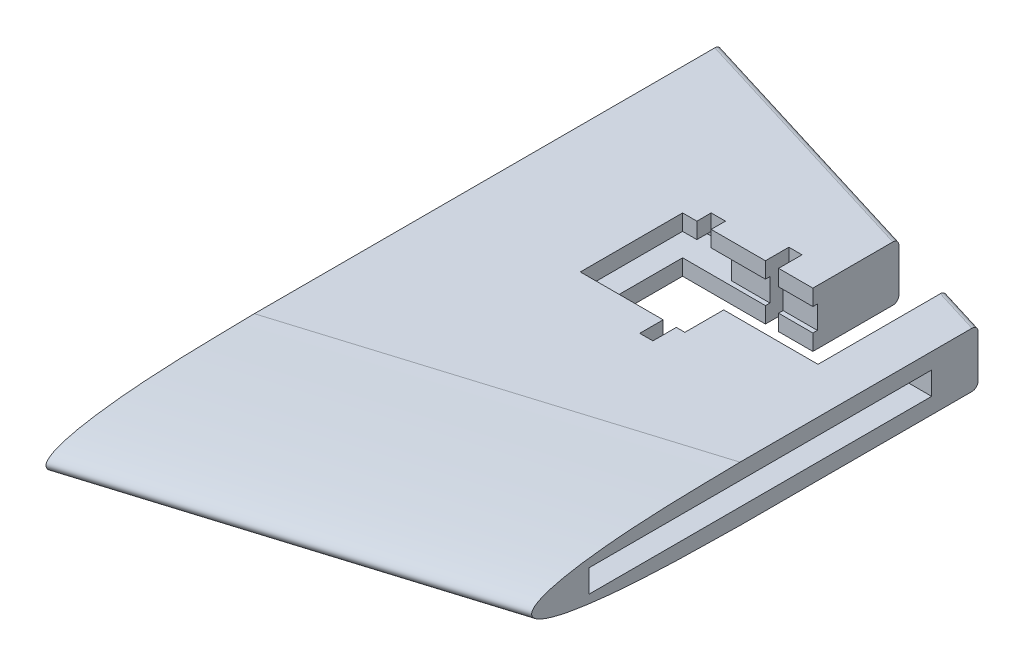
from build123d import *

# Parameters (mm, degrees)
SKETCH7_W          = 76.2
SKETCH7_H          = 5.08
CUT_EXTRUDE3_DEPTH = 194.950570427
CUT_EXTRUDE4_DEPTH = 195.237760021
CUT_EXTRUDE5_DEPTH = 172.648324818
SKETCH10_W         = 15.24
SKETCH10_H         = 38.1
CUT_EXTRUDE6_DEPTH = 172.648324818
SKETCH12_W         = 6.35
SKETCH12_H         = 5.08
CUT_EXTRUDE8_DEPTH = 38.1
CUT_EXTRUDE9_REACH = 173.648
SKETCH13_W         = 3.175
SKETCH13_H         = 3.175
FILLET1_R          = 1.27


with BuildPart() as part:
    # Sweep1: sweep along a path in Sketch4
    with BuildLine(Plane(origin=(0, 0, 0), x_dir=(1, 0, 0), z_dir=(0, 1, 0))) as sweep1_path:
        Line((0, 0), (82.55, 25.4))
    # Sketch3 → Sweep1 (sweep)
    with BuildSketch(Plane(origin=(0, 0, 0), x_dir=(0, 0, -1), z_dir=(1, 0, 0))):
        with BuildLine():
            Line((150, 6.096), (150, -6.096))
            Line((150, -6.096), (46.3, -6.096))
            add(Edge.make_bspline(
                [(46.3, 6.096), (42.804492563, 5.969490826), (37.675525192, 5.983000948), (31.005483641, 5.782593876), (26.391349913, 5.588669786), (22.073997277, 5.329197251), (18.081699811, 5.020010163), (14.441982882, 4.626202737), (11.172305542, 4.205923398), (8.298388415, 3.735651001), (5.83348217, 3.213598048), (3.793787979, 2.654186778), (2.174423999, 2.077410698), (1.000609399, 1.452296859), (0.218267158, 0.802287486), (-0.094373608, 0), (0.218267158, -0.802287486), (1.000609399, -1.452296859), (2.174423999, -2.077410698), (3.793787979, -2.654186778), (5.83348217, -3.213598048), (8.298388415, -3.735651001), (11.172305542, -4.205923398), (14.441982882, -4.626202737), (18.081699811, -5.020010163), (22.073997277, -5.329197251), (26.391349913, -5.588669786), (31.005483641, -5.782593876), (37.675525192, -5.983000948), (42.804492563, -5.969490826), (46.3, -6.096)],
                knots=[0, 0, 0, 0, 0.110232916, 0.161631458, 0.210322584, 0.255793418, 0.297954265, 0.336521807, 0.371174306, 0.401850828, 0.42829023, 0.450544731, 0.468498492, 0.48232621, 0.492358267, 0.5, 0.507641733, 0.51767379, 0.531501508, 0.549455269, 0.57170977, 0.598149172, 0.628825694, 0.663478193, 0.702045735, 0.744206582, 0.789677416, 0.838368542, 0.889767084, 1, 1, 1, 1], degree=3))
            Line((46.3, 6.096), (150, 6.096))
        make_face()
    sweep(path=sweep1_path.line)

    # Sketch7 → Cut-Extrude3 (cut, through all)
    with BuildSketch(Plane.ZY):
        with Locations((-76.2, 0)):
            Rectangle(SKETCH7_W, SKETCH7_H)
    extrude(amount=-CUT_EXTRUDE3_DEPTH, mode=Mode.SUBTRACT)

    # Sketch8 → Cut-Extrude4 (cut, through all)
    with BuildSketch(Plane(origin=(0, 6.096, 0), x_dir=(1, 0, 0), z_dir=(0, 1, 0))):
        Polygon((0, 150), (82.55, 124.6), (82.55, 175.4), (0, 175.4), align=None)
    extrude(amount=-CUT_EXTRUDE4_DEPTH, mode=Mode.SUBTRACT)

    # Sketch9 → Cut-Extrude5 (cut, through all)
    with BuildSketch(Plane(origin=(0, 6.096, 0), x_dir=(1, 0, 0), z_dir=(0, 1, 0))):
        Polygon((28.194, 113.297), (46.609, 113.297), (46.609, 118.504), (49.53, 118.504), (49.53, 113.297), (57.15, 113.297), (57.15, 99.2), (51.435, 99.2), (51.435, 90.564), (49.53, 90.564), (49.53, 85.357), (46.609, 85.357), (46.609, 90.564), (28.194, 90.564), align=None)
    extrude(amount=-CUT_EXTRUDE5_DEPTH, mode=Mode.SUBTRACT)

    # Sketch10 → Cut-Extrude6 (cut, through all)
    with BuildSketch(Plane(origin=(0, 6.096, 0), x_dir=(1, 0, 0), z_dir=(0, 1, 0))):
        with Locations((64.77, 118.25)):
            Rectangle(SKETCH10_W, SKETCH10_H)
    extrude(amount=-CUT_EXTRUDE6_DEPTH, mode=Mode.SUBTRACT)

    # Sketch12 → Cut-Extrude8 (cut)
    with BuildSketch(Plane.ZY):
        with Locations((-117.475, 0)):
            Rectangle(SKETCH12_W, SKETCH12_H)
    extrude(amount=-CUT_EXTRUDE8_DEPTH, mode=Mode.SUBTRACT)

    # Sketch13 → Cut-Extrude9 (cut, up to next)
    with BuildSketch(Plane(origin=(0, 6.096, 0), x_dir=(1, 0, 0), z_dir=(0, 1, 0)), mode=Mode.PRIVATE) as cut_extrude9_sk1:
        with Locations((32.9565, 114.8845)):
            Rectangle(SKETCH13_W, SKETCH13_H)
    cut_extrude9_tool1 = extrude(cut_extrude9_sk1.sketch, amount=-CUT_EXTRUDE9_REACH, mode=Mode.PRIVATE) & part.part
    add(cut_extrude9_tool1.solids().sort_by_distance((32.9565, 6.096, -114.8845))[0], mode=Mode.SUBTRACT)

    # Fillet1
    fillet1_edges = [part.edges().sort_by_distance(p)[0] for p in [
        (77.47, -6.096, -126.163076923),
        (77.47, 6.096, -126.163076923),
        (28.575, -6.096, -141.207692308),
        (28.575, 6.096, -141.207692308),
    ]]
    fillet(fillet1_edges, radius=FILLET1_R)


solid = part.part
